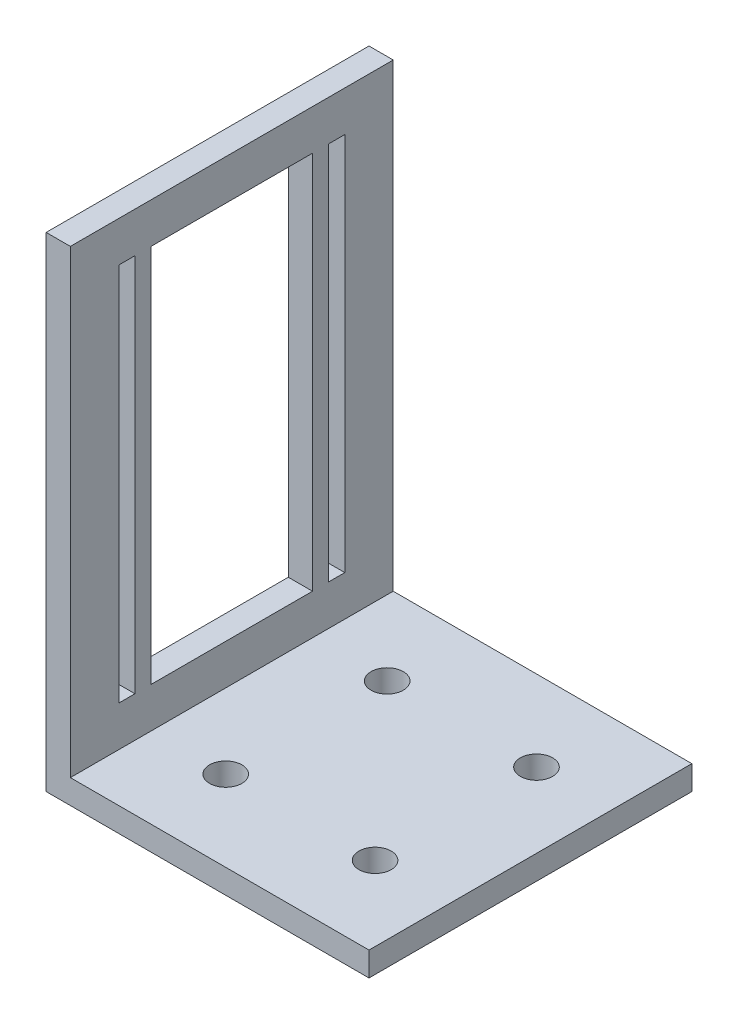
from build123d import *

# Parameters (mm, degrees)
BOSS_EXTRUDE1_DEPTH = 40
SKETCH2_R           = 2
CUT_EXTRUDE1_DEPTH  = 40
SKETCH3_W           = 2
SKETCH3_H           = 47
SKETCH3_W_2         = 20
CUT_EXTRUDE2_DEPTH  = 83.462112512


with BuildPart() as part:
    # Sketch1 → Boss-Extrude1 (new body)
    with BuildSketch(Plane.XY):
        Polygon((0, 0), (-40, 0), (-40, 60), (-37, 60), (-37, 3), (0, 3), align=None)
    extrude(amount=BOSS_EXTRUDE1_DEPTH)

    # Sketch2 → Cut-Extrude1 (cut)
    with BuildSketch(Plane(origin=(0, 3, 0), x_dir=(1, 0, 0), z_dir=(0, 1, 0))):
        with Locations(Location((-9.25, -30, 0), (0, 0, 270))):
            Circle(SKETCH2_R)
        with Locations(Location((-27.75, -30, 0), (0, 0, 270))):
            Circle(SKETCH2_R)
        with Locations(Location((-27.75, -10, 0), (0, 0, 270))):
            Circle(SKETCH2_R)
        with Locations(Location((-9.25, -10, 0), (0, 0, 270))):
            Circle(SKETCH2_R)
    extrude(amount=-CUT_EXTRUDE1_DEPTH, mode=Mode.SUBTRACT)

    # Sketch3 → Cut-Extrude2 (cut, through all)
    with BuildSketch(Plane.ZY.offset(40)):
        with Locations((33, 31.5)):
            Rectangle(SKETCH3_W, SKETCH3_H)
        with Locations((7, 31.5)):
            Rectangle(SKETCH3_W, SKETCH3_H)
        with Locations((20, 31.5)):
            Rectangle(SKETCH3_W_2, SKETCH3_H)
    extrude(amount=-CUT_EXTRUDE2_DEPTH, mode=Mode.SUBTRACT)


solid = part.part
